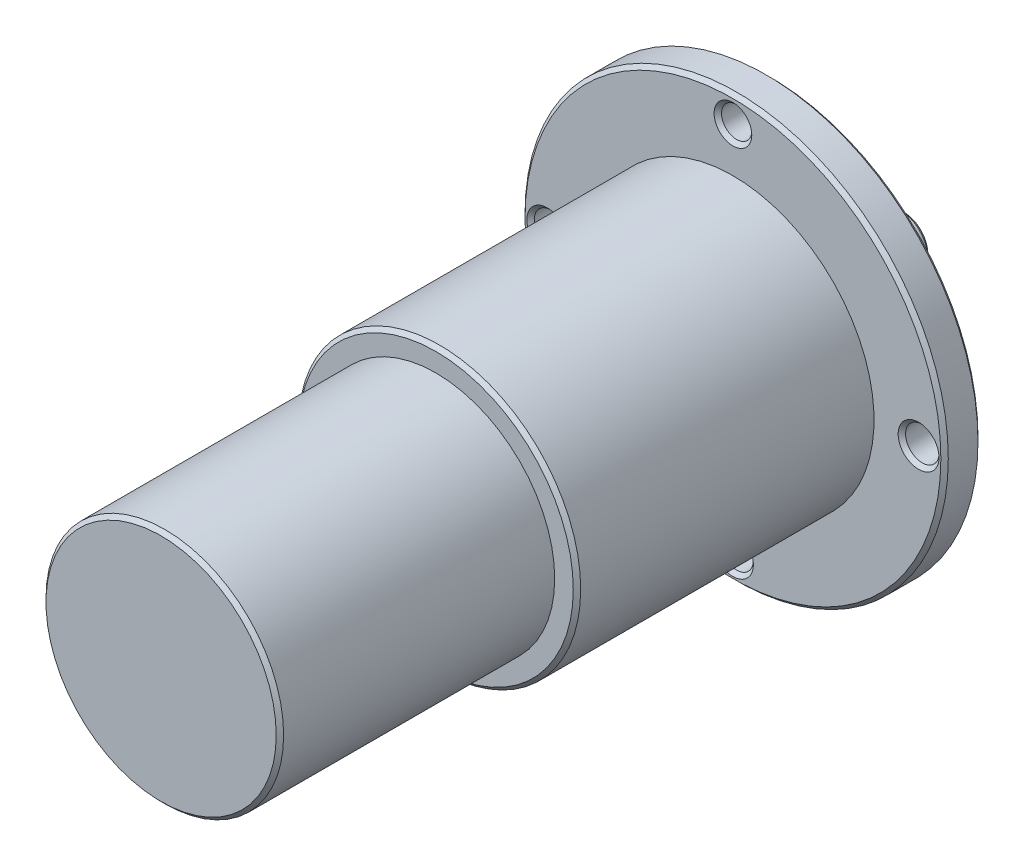
from build123d import *

# Parameters (mm, degrees)
SKETCH2_R          = 2.25
SKETCH2_R_2        = 2.036849222
CUT_EXTRUDE1_DEPTH = 10
CHAMFER1_SIZE      = 0.5
CHAMFER2_SIZE      = 0.5


with BuildPart() as part:
    # Sketch1 → Revolve1 (revolve)
    with BuildSketch(Plane(origin=(0, 0, 0), x_dir=(1, 0, 0), z_dir=(0, 1, 0))):
        Polygon((-29.626724138, 24.634482759), (-33.376724138, 24.634482759), (-33.376724138, 9.634482759), (-42.126724138, 9.634482759), (-42.126724138, 6.634482759), (-58.126724138, 6.634482759), (-58.126724138, 1.634482759), (-48.626724138, 1.634482759), (-48.626724138, -38.365517241), (-45.626724138, -38.365517241), (-45.626724138, -75.365517241), (-29.626724138, -75.365517241), align=None)
    revolve(axis=Axis((-29.626724138, 0, -29.85316092), (0, 0, 1)))

    # Sketch2 → Cut-Extrude1 (cut)
    with BuildSketch(Plane.XY.offset(-1.634482759)):
        with Locations((-4.626724138, 0)):
            Circle(SKETCH2_R)
        with Locations((-29.626724138, 25)):
            Circle(SKETCH2_R_2)
        with Locations((-54.626724138, 0)):
            Circle(SKETCH2_R)
        with Locations((-29.626724138, -25)):
            Circle(SKETCH2_R)
    extrude(amount=-CUT_EXTRUDE1_DEPTH, mode=Mode.SUBTRACT)

    # Chamfer1
    chamfer1_edges = [part.edges().sort_by_distance(p)[0] for p in [
        (-6.876724138, 0, -6.634482759),
        (-6.876724138, 0, -1.634482759),
        (-31.66357336, 25, -6.634482759),
        (-31.66357336, 25, -1.634482759),
        (-56.876724138, 0, -6.634482759),
        (-56.876724138, 0, -1.634482759),
        (-31.876724138, -25, -6.634482759),
        (-31.876724138, -25, -1.634482759),
        (-25.876724138, 0, -24.634482759),
        (-17.126724138, 0, -9.634482759),
        (-1.126724138, 0, -6.634482759),
        (-1.126724138, 0, -1.634482759),
    ]]
    chamfer(chamfer1_edges, length=CHAMFER1_SIZE)

    # Chamfer2
    chamfer2_edges = [part.edges().sort_by_distance(p)[0] for p in [
        (-10.626724138, 0, 38.365517241),
        (-13.626724138, 0, 75.365517241),
    ]]
    chamfer(chamfer2_edges, length=CHAMFER2_SIZE)


solid = part.part
